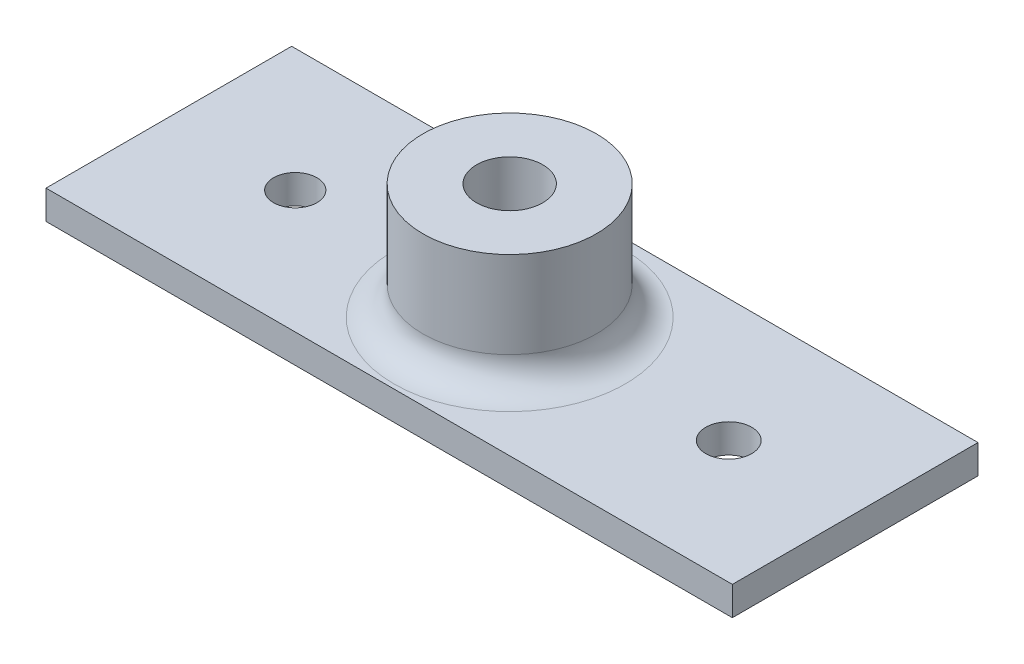
from build123d import *

# Parameters (mm, degrees)
SKETCH1_W           = 47.5
SKETCH1_H           = 17
BOSS_EXTRUDE1_DEPTH = 2
SKETCH2_R           = 2.487228871
SKETCH2_R_2         = 1.586318918
SKETCH2_R_3         = 1.5
CUT_EXTRUDE2_DEPTH  = 2
SKETCH5_R           = 6
SKETCH5_R_2         = 2.286753702
BOSS_EXTRUDE3_DEPTH = 8
FILLET1_R           = 2


with BuildPart() as part:
    # Sketch1 → Boss-Extrude1 (new body)
    with BuildSketch(Plane(origin=(0, 0, 0), x_dir=(1, 0, 0), z_dir=(0, 1, 0))):
        with Locations((-12.778061224, 6.635204082)):
            Rectangle(SKETCH1_W, SKETCH1_H)
    extrude(amount=BOSS_EXTRUDE1_DEPTH)

    # Sketch2 → Cut-Extrude2 (cut)
    with BuildSketch(Plane(origin=(0, 2, 0), x_dir=(1, 0, 0), z_dir=(0, 1, 0))):
        with Locations(Location((-12.778061224, 6.635204082, 0), (0, 0, 270))):
            Circle(SKETCH2_R)
        with Locations(Location((2.221938776, 6.635204082, 0), (0, 0, 270))):
            Circle(SKETCH2_R_2)
        with Locations(Location((-27.778061224, 6.635204082, 0), (0, 0, 270))):
            Circle(SKETCH2_R_3)
    extrude(amount=-CUT_EXTRUDE2_DEPTH, mode=Mode.SUBTRACT)

    # Sketch5 → Boss-Extrude3 (add)
    with BuildSketch(Plane(origin=(0, 2, 0), x_dir=(1, 0, 0), z_dir=(0, 1, 0))):
        with Locations(Location((-12.741585604, 6.438075133, 0), (0, 0, 270))):
            Circle(SKETCH5_R)
        with Locations(Location((-12.741585604, 6.438075133, 0), (0, 0, 280.48311938))):
            Circle(SKETCH5_R_2, mode=Mode.SUBTRACT)
    extrude(amount=BOSS_EXTRUDE3_DEPTH)

    # Fillet1
    fillet1_edges = [part.edges().sort_by_distance(p)[0] for p in [
        (-12.741585604, 2, -12.438075133),
    ]]
    fillet(fillet1_edges, radius=FILLET1_R)


solid = part.part
